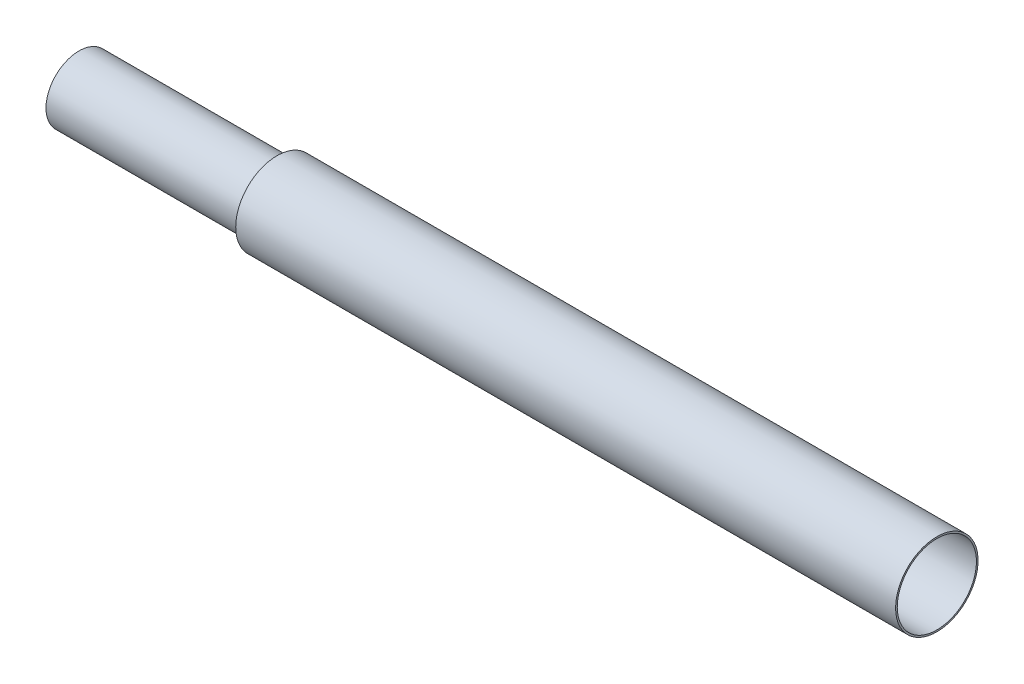
from build123d import *


with BuildPart() as part:
    # Sketch1 → Revolve-Thin1 (revolve)
    with BuildSketch(Plane.XY, mode=Mode.PRIVATE) as revolve_thin1_sk:
        Polygon((0, 200), (1200, 200), (1200, 250), (5200, 250), (5200, 240), (1210, 240), (1210, 190), (0, 190), align=None)
    revolve(revolve_thin1_sk.sketch.rotate(Axis((0, 0, 0), (1, 0, 0)), 90), axis=Axis((0, 0, 0), (1, 0, 0)))


solid = part.part
